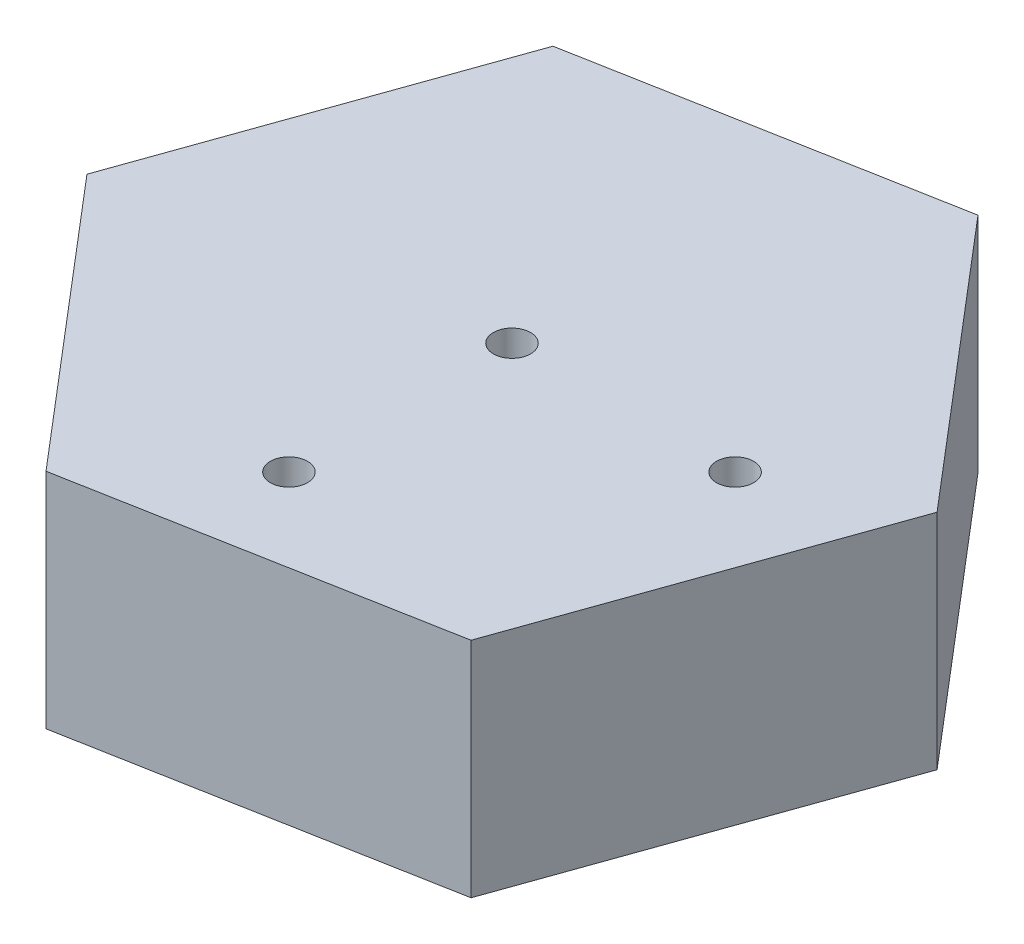
from build123d import *

# Parameters (mm, degrees)
SALIENTE_EXTRUIR1_DEPTH = 30
CROQUIS2_R              = 2.5
CORTAR_EXTRUIR1_DEPTH   = 5
CROQUIS3_R              = 2.5
CORTAR_EXTRUIR2_DEPTH   = 74.264929004


with BuildPart() as part:
    # Croquis1 → Saliente-Extruir1 (new body)
    with BuildSketch(Plane(origin=(0, 0, 0), x_dir=(1, 0, 0), z_dir=(0, 1, 0))):
        Polygon((-31.838337555, 37.345061187), (-48.260940471, -8.900278543), (-16.422602917, -46.24533973), (31.838337555, -37.345061187), (48.260940471, 8.900278543), (16.422602917, 46.24533973), align=None)
    extrude(amount=SALIENTE_EXTRUIR1_DEPTH)

    # Croquis2 → Cortar-Extruir1 (cut)
    with BuildSketch(Plane(origin=(0, 30, 0), x_dir=(1, 0, 0), z_dir=(0, 1, 0))):
        with Locations(Location((0, 0, 0), (0, 0, 270))):
            Circle(CROQUIS2_R)
    extrude(amount=-CORTAR_EXTRUIR1_DEPTH, mode=Mode.SUBTRACT)

    # Croquis3 → Cortar-Extruir2 (cut, through all)
    with BuildSketch(Plane.XZ):
        with Locations(Location((0, 30, 0), (0, 0, 270))):
            Circle(CROQUIS3_R)
        with Locations(Location((30, 0, 0), (0, 0, 270))):
            Circle(CROQUIS3_R)
    extrude(amount=-CORTAR_EXTRUIR2_DEPTH, mode=Mode.SUBTRACT)


solid = part.part
